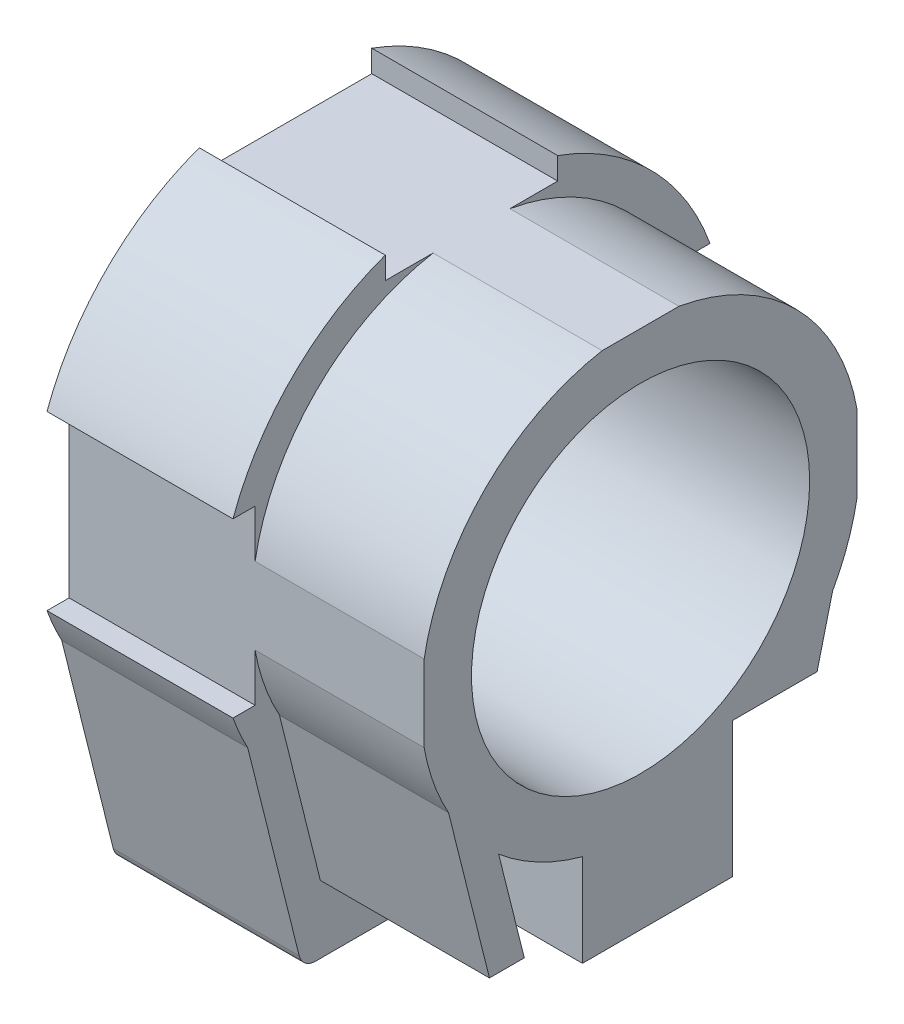
from build123d import *

# Parameters (mm, degrees)
CROQUIS1_R              = 10
SALIENTE_EXTRUIR1_DEPTH = 11
CROQUIS2_R              = 10
SALIENTE_EXTRUIR2_DEPTH = 10
CORTAR_EXTRUIR3_START   = -10
CORTAR_EXTRUIR3_DEPTH   = 10
CROQUIS8_R              = 1.55
CORTAR_EXTRUIR4_DEPTH   = 5
CORTAR_EXTRUIR5_REACH   = 52.656


with BuildPart() as part:
    # Croquis1 → Saliente-Extruir1 (new body)
    with BuildSketch(Plane(origin=(0, 0, 0), x_dir=(0, 0, -1), z_dir=(1, 0, 0))):
        with BuildLine():
            Line((-5.780776406, 0), (-24.219223594, 0))
            ThreePointArc((-24.219223594, 0), (-24.834635803, 0.211794562), (-25.189366094, 0.757464375))
            Line((-25.189366094, 0.757464375), (-28.235294118, 12.941176471))
            ThreePointArc((-28.235294118, 12.941176471), (-15, 35), (-1.764705882, 12.941176471))
            Line((-1.764705882, 12.941176471), (-4.810633906, 0.757464375))
            ThreePointArc((-4.810633906, 0.757464375), (-5.165364197, 0.211794562), (-5.780776406, 0))
        make_face()
        with Locations((-15, 20)):
            Circle(CROQUIS1_R, mode=Mode.SUBTRACT)
    extrude(amount=SALIENTE_EXTRUIR1_DEPTH)

    # Croquis2 → Saliente-Extruir2 (add)
    with BuildSketch(Plane(origin=(11, 0, 0), x_dir=(0, 0, -1), z_dir=(1, 0, 0))):
        with BuildLine():
            Line((-23.438447187, 2), (-6.561552813, 2))
            Line((-6.561552813, 2), (-3.643105675, 13.673788552))
            ThreePointArc((-3.643105675, 13.673788552), (-15, 33), (-26.356894325, 13.673788552))
            Line((-26.356894325, 13.673788552), (-23.438447187, 2))
        make_face()
        with Locations((-15, 20)):
            Circle(CROQUIS2_R, mode=Mode.SUBTRACT)
    extrude(amount=SALIENTE_EXTRUIR2_DEPTH)

    # Croquis3 → Cortar-Extruir3 (cut)
    with BuildSketch(Plane(origin=(21, 0, 0), x_dir=(0, 0, -1), z_dir=(1, 0, 0)).offset(CORTAR_EXTRUIR3_START)):
        Polygon((-9.561552813, 2), (-9.561552813, 10), (-4.561552813, 10), (-6.561552813, 2), align=None)
        with BuildLine():
            Line((-23.438447187, 2), (-18.438447187, 2))
            Line((-18.438447187, 2), (-18.438447187, 6.945227656))
            Line((-18.438447187, 6.945227656), (-18.438447187, 7.462971606))
            ThreePointArc((-18.438447187, 7.462971606), (-21.059353424, 8.498511571), (-23.395524099, 10.074518898))
            Line((-23.395524099, 10.074518898), (-23.194590952, 9.270786312))
            Line((-23.194590952, 9.270786312), (-21.876894374, 4))
            Line((-21.876894374, 4), (-23.938447187, 4))
            Line((-23.938447187, 4), (-23.438447187, 2))
        make_face()
    extrude(amount=CORTAR_EXTRUIR3_DEPTH, mode=Mode.SUBTRACT)

    # Croquis8 → Cortar-Extruir4 (cut)
    with BuildSketch(Plane.XZ.offset(-2)):
        with Locations(Location((16, 14, 0), (0, 0, 270))):
            Circle(CROQUIS8_R)
    extrude(amount=-CORTAR_EXTRUIR4_DEPTH, mode=Mode.SUBTRACT)

    # Croquis9 → Cortar-Extruir5 (cut, up to next)
    with BuildSketch(Plane.ZY, mode=Mode.PRIVATE) as cortar_extruir5_sk1:
        with BuildLine():
            Line((2.2, 20), (2.2, 25.1))
            Line((2.2, 25.1), (0.893618465, 25.1))
            ThreePointArc((0.893618465, 25.1), (0, 20), (0.893618465, 14.9))
            Line((0.893618465, 14.9), (2.2, 14.9))
            Line((2.2, 14.9), (2.2, 20))
        make_face()
    cortar_extruir5_tool1 = extrude(cortar_extruir5_sk1.sketch, amount=-CORTAR_EXTRUIR5_REACH, mode=Mode.PRIVATE) & part.part
    # Croquis9 → Cortar-Extruir5 (cut, up to next)
    with BuildSketch(Plane.ZY, mode=Mode.PRIVATE) as cortar_extruir5_sk2:
        with BuildLine():
            Line((15, 32.8), (20.1, 32.8))
            Line((20.1, 32.8), (20.1, 34.106381535))
            ThreePointArc((20.1, 34.106381535), (15, 35), (9.9, 34.106381535))
            Line((9.9, 34.106381535), (9.9, 32.8))
            Line((9.9, 32.8), (15, 32.8))
        make_face()
    cortar_extruir5_tool2 = extrude(cortar_extruir5_sk2.sketch, amount=-CORTAR_EXTRUIR5_REACH, mode=Mode.PRIVATE) & part.part
    # Croquis9 → Cortar-Extruir5 (cut, up to next)
    with BuildSketch(Plane.ZY, mode=Mode.PRIVATE) as cortar_extruir5_sk3:
        with BuildLine():
            Line((27.8, 14.9), (29.106381535, 14.9))
            ThreePointArc((29.106381535, 14.9), (30, 20), (29.106381535, 25.1))
            Line((29.106381535, 25.1), (27.8, 25.1))
            Line((27.8, 25.1), (27.8, 20))
            Line((27.8, 20), (27.8, 14.9))
        make_face()
    cortar_extruir5_tool3 = extrude(cortar_extruir5_sk3.sketch, amount=-CORTAR_EXTRUIR5_REACH, mode=Mode.PRIVATE) & part.part
    add(cortar_extruir5_tool1.solids().sort_by_distance((0, 20, 1.228659))[0], mode=Mode.SUBTRACT)
    add(cortar_extruir5_tool2.solids().sort_by_distance((0, 33.771341, 15))[0], mode=Mode.SUBTRACT)
    add(cortar_extruir5_tool3.solids().sort_by_distance((0, 20, 28.771341))[0], mode=Mode.SUBTRACT)


solid = part.part
